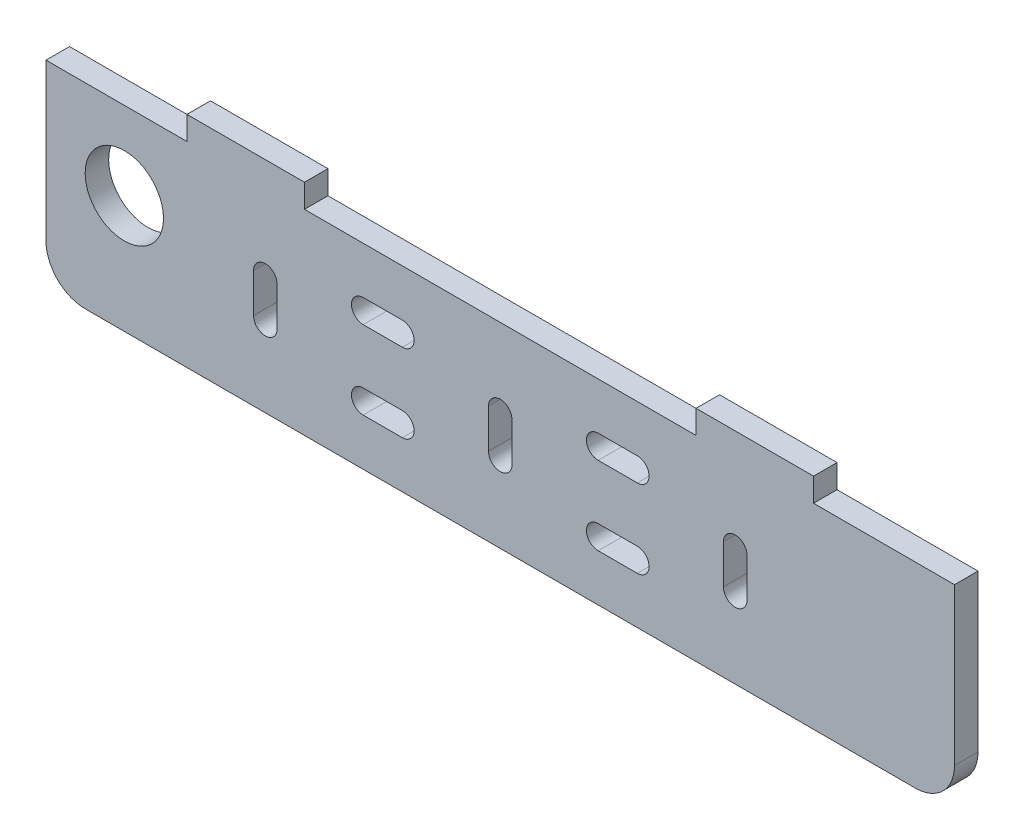
from build123d import *

# Parameters (mm, degrees)
BOSS_EXTRUDE1_DEPTH = 3
SKETCH3_R           = 5
CUT_EXTRUDE2_DEPTH  = 64.229739838
CUT_EXTRUDE3_DEPTH  = 64.229739838


with BuildPart() as part:
    # Sketch1 → Boss-Extrude1 (new body)
    with BuildSketch(Plane.XY):
        with BuildLine():
            Line((-25, 0), (25, 0))
            Line((25, 0), (25, 3))
            Line((25, 3), (40, 3))
            Line((40, 3), (40, 0))
            Line((40, 0), (58, 0))
            Line((58, 0), (58, -20))
            ThreePointArc((58, -20), (56.535533906, -23.535533906), (53, -25))
            Line((53, -25), (-53, -25))
            ThreePointArc((-53, -25), (-56.535533906, -23.535533906), (-58, -20))
            Line((-58, -20), (-58, 0))
            Line((-58, 0), (-40, 0))
            Line((-40, 0), (-40, 3))
            Line((-40, 3), (-25, 3))
            Line((-25, 3), (-25, 0))
        make_face()
    extrude(amount=BOSS_EXTRUDE1_DEPTH)

    # Sketch3 → Cut-Extrude2 (cut, through all)
    with BuildSketch(Plane(origin=(0, 0, 0), x_dir=(-1, 0, 0), z_dir=(0, 0, -1))):
        with Locations((48, -10)):
            Circle(SKETCH3_R)
    extrude(amount=-CUT_EXTRUDE2_DEPTH, mode=Mode.SUBTRACT)

    # Sketch4 → Cut-Extrude3 (cut, through all)
    with BuildSketch(Plane(origin=(0, 0, 0), x_dir=(-1, 0, 0), z_dir=(0, 0, -1))):
        with BuildLine():
            Line((-28.5, -10), (-28.5, -15))
            ThreePointArc((-28.5, -15), (-30, -16.5), (-31.5, -15))
            Line((-31.5, -15), (-31.5, -10))
            ThreePointArc((-31.5, -10), (-30, -8.5), (-28.5, -10))
        make_face()
        with BuildLine():
            Line((-17.5, -6), (-12.5, -6))
            ThreePointArc((-12.5, -6), (-11, -7.5), (-12.5, -9))
            Line((-12.5, -9), (-17.5, -9))
            ThreePointArc((-17.5, -9), (-19, -7.5), (-17.5, -6))
        make_face()
        with BuildLine():
            Line((-1.5, -15), (-1.5, -10))
            ThreePointArc((-1.5, -10), (0, -8.5), (1.5, -10))
            Line((1.5, -10), (1.5, -15))
            ThreePointArc((1.5, -15), (0, -16.5), (-1.5, -15))
        make_face()
        with BuildLine():
            Line((28.5, -15), (28.5, -10))
            ThreePointArc((28.5, -10), (30, -8.5), (31.5, -10))
            Line((31.5, -10), (31.5, -15))
            ThreePointArc((31.5, -15), (30, -16.5), (28.5, -15))
        make_face()
        with BuildLine():
            Line((12.5, -6), (17.5, -6))
            ThreePointArc((17.5, -6), (19, -7.5), (17.5, -9))
            Line((17.5, -9), (12.5, -9))
            ThreePointArc((12.5, -9), (11, -7.5), (12.5, -6))
        make_face()
        with BuildLine():
            Line((12.5, -16), (17.5, -16))
            ThreePointArc((17.5, -16), (19, -17.5), (17.5, -19))
            Line((17.5, -19), (12.5, -19))
            ThreePointArc((12.5, -19), (11, -17.5), (12.5, -16))
        make_face()
        with BuildLine():
            Line((-17.5, -16), (-12.5, -16))
            ThreePointArc((-12.5, -16), (-11, -17.5), (-12.5, -19))
            Line((-12.5, -19), (-17.5, -19))
            ThreePointArc((-17.5, -19), (-19, -17.5), (-17.5, -16))
        make_face()
    extrude(amount=-CUT_EXTRUDE3_DEPTH, mode=Mode.SUBTRACT)


solid = part.part
